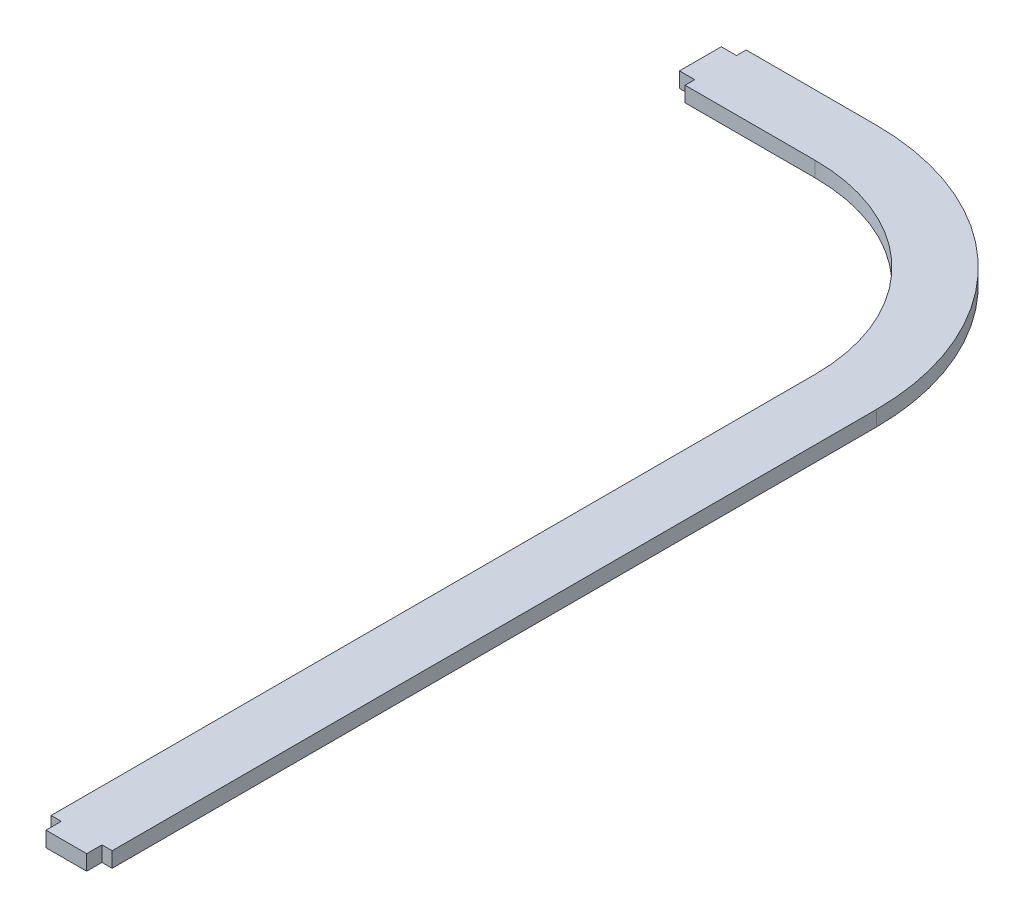
from build123d import *

# Parameters (mm, degrees)
SALIENTE_EXTRUIR1_DEPTH = 3


with BuildPart() as part:
    # Croquis1 → Saliente-Extruir1 (new body)
    with BuildSketch(Plane(origin=(0, 0, 0), x_dir=(1, 0, 0), z_dir=(0, 1, 0))):
        with BuildLine():
            Line((0, 7.786096257), (0, 0))
            Line((0, 0), (0, -0.213903743))
            Line((0, -0.213903743), (3, -0.213903743))
            Line((3, -0.213903743), (3, -2.106951872))
            Line((3, -2.106951872), (7.35828877, -2.106951872))
            Line((7.35828877, -2.106951872), (28.573593129, -2.106951872))
            ThreePointArc((28.573593129, -2.106951872), (54.330952442, -12.77599943), (65, -38.533358743))
            Line((65, -38.533358743), (65, -117.736951872))
            Line((65, -117.736951872), (65, -188.736951872))
            Line((65, -188.736951872), (67, -188.736951872))
            Line((67, -188.736951872), (67, -191.736951872))
            Line((67, -191.736951872), (75, -191.736951872))
            Line((75, -191.736951872), (75, -188.736951872))
            Line((75, -188.736951872), (77, -188.736951872))
            Line((77, -188.736951872), (77, -38.533358743))
            ThreePointArc((77, -38.533358743), (62.816233816, -4.290718056), (28.573593129, 9.893048128))
            Line((28.573593129, 9.893048128), (3, 9.893048128))
            Line((3, 9.893048128), (3, 8))
            Line((3, 8), (0, 8))
            Line((0, 8), (0, 7.786096257))
        make_face()
    extrude(amount=SALIENTE_EXTRUIR1_DEPTH)


solid = part.part
